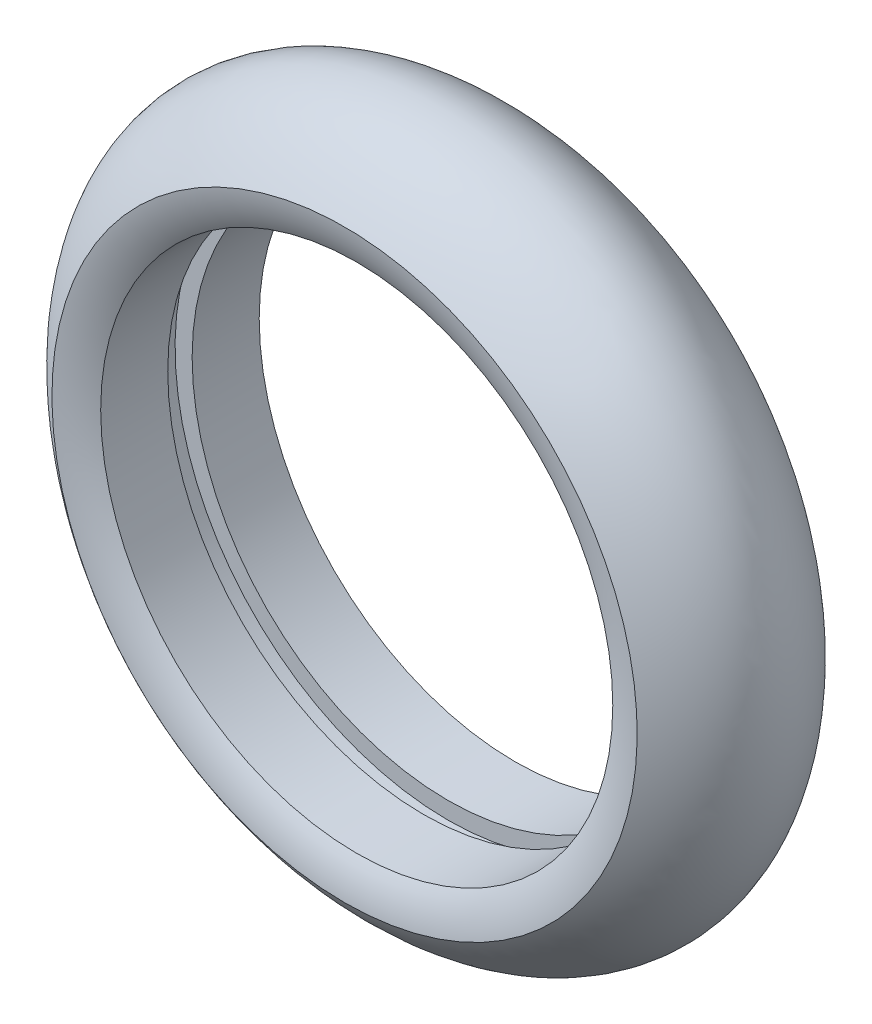
from build123d import *


with BuildPart() as part:
    # Sketch3 → Revolve1 (revolve)
    with BuildSketch(Plane(origin=(0, 0, 0), x_dir=(0, 0, -1), z_dir=(1, 0, 0)), mode=Mode.PRIVATE) as revolve1_sk:
        with BuildLine():
            Line((-6.5, 21), (-1, 21))
            Line((-1, 21), (-1, 22.4))
            Line((-1, 22.4), (1, 22.4))
            Line((1, 22.4), (1, 21))
            Line((1, 21), (6.5, 21))
            ThreePointArc((6.5, 21), (7.158910532, 22.447029823), (7.5, 24))
            add(Edge.make_bspline(
                [(7.5, 24), (0, 35.041666667), (-7.5, 24)],
                knots=[5.687182868, 5.687182868, 5.687182868, 6.879187746, 6.879187746, 6.879187746], degree=2, weights=[1, 0.827586207, 1]))
            ThreePointArc((-7.5, 24), (-7.158910532, 22.447029823), (-6.5, 21))
        make_face()
    revolve(revolve1_sk.sketch.rotate(Axis((0, 0, 13.360918791), (0, 0, -1)), 180), axis=Axis((0, 0, 13.360918791), (0, 0, -1)))


solid = part.part
